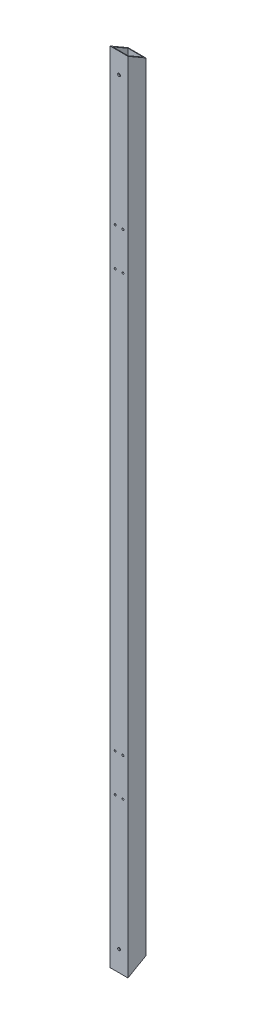
from build123d import *

# Parameters (mm, degrees)
SKETCH1_W                    = 44.45
SKETCH1_H                    = 1980.184
BOSS_EXTRUDE1_DEPTH          = 44.45
SKETCH2_W                    = 38.1
SKETCH2_H                    = 38.1
CUT_EXTRUDE1_DEPTH           = 1981.807518913
CUT_EXTRUDE2_DEPTH           = 993.085567612
SKETCH13_R                   = 3.3734375
CUT_EXTRUDE7_DEPTH           = 992.338449567
F_10_0_1935_DIAMETER_HOLE1_D = 4.9149


with BuildPart() as part:
    # Sketch1 → Boss-Extrude1 (new body)
    with BuildSketch(Plane.XY):
        Rectangle(SKETCH1_W, SKETCH1_H)
    extrude(amount=BOSS_EXTRUDE1_DEPTH)

    # Sketch2 → Cut-Extrude1 (cut, through all)
    with BuildSketch(Plane(origin=(0, 990.092, 0), x_dir=(1, 0, 0), z_dir=(0, 1, 0))):
        with Locations((0, -22.225)):
            Rectangle(SKETCH2_W, SKETCH2_H)
    extrude(amount=-CUT_EXTRUDE1_DEPTH, mode=Mode.SUBTRACT)

    # Sketch3 → Cut-Extrude2 (cut, through all)
    with BuildSketch(Plane(origin=(22.225, 0, 0), x_dir=(0, 0, -1), z_dir=(1, 0, 0))):
        Polygon((-44.45, 990.092), (0, 964.428780535), (0, 990.092), align=None)
        Polygon((-44.45, -990.092), (0, -964.428780535), (0, -990.092), align=None)
    extrude(amount=-CUT_EXTRUDE2_DEPTH, mode=Mode.SUBTRACT)

    # Sketch13 → Cut-Extrude7 (cut, through all)
    with BuildSketch(Plane.XY.offset(44.45)):
        with Locations((0, 939.038)):
            Circle(SKETCH13_R)
        with Locations((0, -939.038)):
            Circle(SKETCH13_R)
    extrude(amount=-CUT_EXTRUDE7_DEPTH, mode=Mode.SUBTRACT)

    # #10 (0.1935) Diameter Hole1 (through all)
    with Locations(Plane(origin=(-9.525, -612.1654, 44.45), x_dir=(1, 0, 0), z_dir=(0, 0, 1))):
        with Locations((0, 0), (19.05, 0), (0, 94.0308), (19.05, 94.0308), (0, 1130.3), (19.05, 1130.3), (0, 1224.3308), (19.05, 1224.3308)):
            Hole(F_10_0_1935_DIAMETER_HOLE1_D / 2)


solid = part.part
